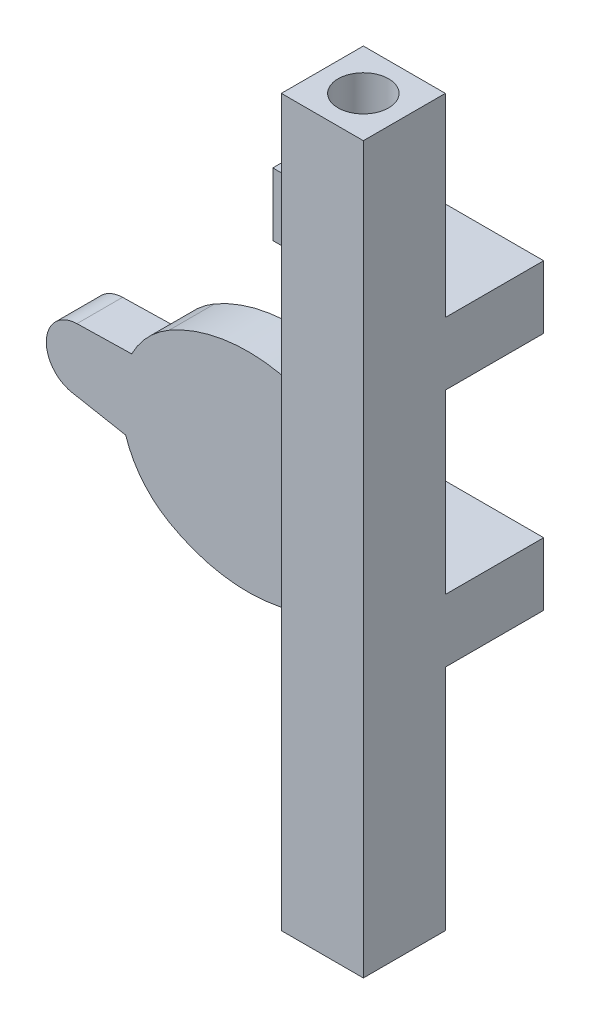
from build123d import *

# Parameters (mm, degrees)
BOSS_EXTRUDE1_DEPTH      = 3.800000096
BOSS_EXTRUDE2_DEPTH      = 2
BOSS_EXTRUDE3_DEPTH      = 38.1
BOSS_EXTRUDE3_DEPTH_BACK = 38.1
BOSS_EXTRUDE4_START      = 38.1
SKETCH11_W               = 10.4262
SKETCH11_H               = 10.4262
SKETCH11_R               = 3.2131
BOSS_EXTRUDE4_DEPTH      = 8
BOSS_EXTRUDE5_START      = -38.1
SKETCH11_2_W             = 10.4262
SKETCH11_2_H             = 10.4262
SKETCH11_2_R             = 3.2131
BOSS_EXTRUDE5_DEPTH      = 8
BOSS_EXTRUDE6_DEPTH      = 8
BOSS_EXTRUDE7_DEPTH      = 8
SKETCH15_R               = 1.1
CUT_EXTRUDE1_DEPTH       = 8


with BuildPart() as part:
    # Sketch7 → Boss-Extrude1 (new body)
    with BuildSketch(Plane.XY):
        with BuildLine():
            ThreePointArc((-33.515331309, 5.433002286), (-37.398650401, 1.777981375), (-34.162442321, -2.460686138))
            Line((-34.162442321, -2.460686138), (-27.319744353, -3.740057236))
            ThreePointArc((-27.319744353, -3.740057236), (-25.198740105, -7.664015147), (-21.808759445, -10.563003905))
            ThreePointArc((-21.808759445, -10.563003905), (-12.24514023, -13.245034669), (-2.567249995, -11.010187448))
            ThreePointArc((-2.567249995, -11.010187448), (1.4351, 0), (-2.567249995, 11.010187448))
            ThreePointArc((-2.567249995, 11.010187448), (-12.24514023, 13.245034669), (-21.808759445, 10.563003905))
            ThreePointArc((-21.808759445, 10.563003905), (-24.540834155, 8.413644492), (-26.555630229, 5.58087643))
            Line((-26.555630229, 5.58087643), (-33.515331309, 5.433002286))
        make_face()
        with BuildLine():
            Line((-27.37529807, 3.563009393), (-15.791139853, 3.809140291))
            ThreePointArc((-15.791139853, 3.809140291), (-11.912944563, -0.311292991), (-16.410423725, -3.745102876))
            Line((-16.410423725, -3.745102876), (-27.799834704, -1.615638256))
            Line((-27.799834704, -1.615638256), (-33.794874116, -0.49475287))
            ThreePointArc((-33.794874116, -0.49475287), (-35.405337155, 1.614572981), (-33.472846503, 3.433453577))
            Line((-33.472846503, 3.433453577), (-27.37529807, 3.563009393))
        make_face(mode=Mode.SUBTRACT)
    extrude(amount=BOSS_EXTRUDE1_DEPTH)

    # Sketch8 → Boss-Extrude2 (add)
    with BuildSketch(Plane.XY.offset(3.800000096)):
        with BuildLine():
            Line((-26.555630229, 5.58087643), (-33.515331309, 5.433002286))
            ThreePointArc((-33.515331309, 5.433002286), (-37.398650401, 1.777981375), (-34.162442321, -2.460686138))
            Line((-34.162442321, -2.460686138), (-27.319744353, -3.740057236))
            ThreePointArc((-27.319744353, -3.740057236), (-25.198740105, -7.664015147), (-21.808759445, -10.563003905))
            ThreePointArc((-21.808759445, -10.563003905), (-12.24514023, -13.245034669), (-2.567249995, -11.010187448))
            ThreePointArc((-2.567249995, -11.010187448), (1.4351, 0), (-2.567249995, 11.010187448))
            ThreePointArc((-2.567249995, 11.010187448), (-12.24514023, 13.245034669), (-21.808759445, 10.563003905))
            ThreePointArc((-21.808759445, 10.563003905), (-24.540834155, 8.413644492), (-26.555630229, 5.58087643))
        make_face()
    extrude(amount=BOSS_EXTRUDE2_DEPTH)


with BuildPart() as body_2:
    # Sketch10 → Boss-Extrude3 (new, two sides: drawn at the far end of the back side and taken through both)
    with BuildSketch(Plane(origin=(0, 0, 0), x_dir=(1, 0, 0), z_dir=(0, 1, 0)).offset(-BOSS_EXTRUDE3_DEPTH_BACK)):
        Polygon((-5.2131, -6.113100048), (-5.2131, -8.113100048), (5.2131, -8.113100048), (5.2131, 2.313099952), (-5.2131, 2.313099952), (-5.2131, 0.313099952), (0, 0.313099952), (3.2131, 0.313099952), (3.2131, -2.900000048), (3.2131, -6.113100048), (0, -6.113100048), align=None)
    extrude(amount=BOSS_EXTRUDE3_DEPTH + BOSS_EXTRUDE3_DEPTH_BACK)

    # Sketch11 → Boss-Extrude4 (add)
    with BuildSketch(Plane(origin=(0, 0, 0), x_dir=(1, 0, 0), z_dir=(0, 1, 0)).offset(BOSS_EXTRUDE4_START)):
        with Locations((0, -2.900000048)):
            Rectangle(SKETCH11_W, SKETCH11_H)
        with Locations(Location((0, -2.900000048, 0), (0, 0, 270))):
            Circle(SKETCH11_R, mode=Mode.SUBTRACT)
    extrude(amount=BOSS_EXTRUDE4_DEPTH)

    # Sketch11<2> → Boss-Extrude5 (add)
    with BuildSketch(Plane(origin=(0, 0, 0), x_dir=(1, 0, 0), z_dir=(0, 1, 0)).offset(BOSS_EXTRUDE5_START)):
        with Locations((0, -2.900000048)):
            Rectangle(SKETCH11_2_W, SKETCH11_2_H)
        with Locations(Location((0, -2.900000048, 0), (0, 0, 270))):
            Circle(SKETCH11_2_R, mode=Mode.SUBTRACT)
    extrude(amount=-BOSS_EXTRUDE5_DEPTH)

    # Sketch13 → Boss-Extrude6 (add)
    with BuildSketch(Plane(origin=(0, -9.08, 0), x_dir=(1, 0, 0), z_dir=(0, 1, 0))):
        Polygon((-22.228682365, 9.513099952), (-9.172698806, 9.513099952), (-9.172698806, 12.113099952), (-22.228682365, 12.113099952), (-22.228682365, 14.813099952), (5.2131, 14.813099952), (5.2131, 7.813099952), (5.2131, 2.313099952), (-5.2131, 2.313099952), (-5.2131, 7.813099952), (-22.228682365, 7.813099952), align=None)
    extrude(amount=-BOSS_EXTRUDE6_DEPTH)

    # Sketch14 → Boss-Extrude7 (add)
    with BuildSketch(Plane(origin=(0, 13.42, 0), x_dir=(1, 0, 0), z_dir=(0, 1, 0))):
        Polygon((-22.228682365, 9.513099952), (-9.172698806, 9.513099952), (-9.172698806, 12.113099952), (-22.228682365, 12.113099952), (-22.228682365, 14.813099952), (5.2131, 14.813099952), (5.2131, 7.813099952), (5.2131, 2.313099952), (-5.2131, 2.313099952), (-5.2131, 7.813099952), (-22.228682365, 7.813099952), align=None)
    extrude(amount=BOSS_EXTRUDE7_DEPTH)

    # Sketch15 → Cut-Extrude1 (cut)
    with BuildSketch(Plane.XY.offset(-7.813099952)):
        with Locations((-15.272698806, 16.07)):
            Circle(SKETCH15_R)
        with Locations((-15.272698806, -11.73)):
            Circle(SKETCH15_R)
    extrude(amount=-CUT_EXTRUDE1_DEPTH, mode=Mode.SUBTRACT)


solid = Compound([part.part, body_2.part])
